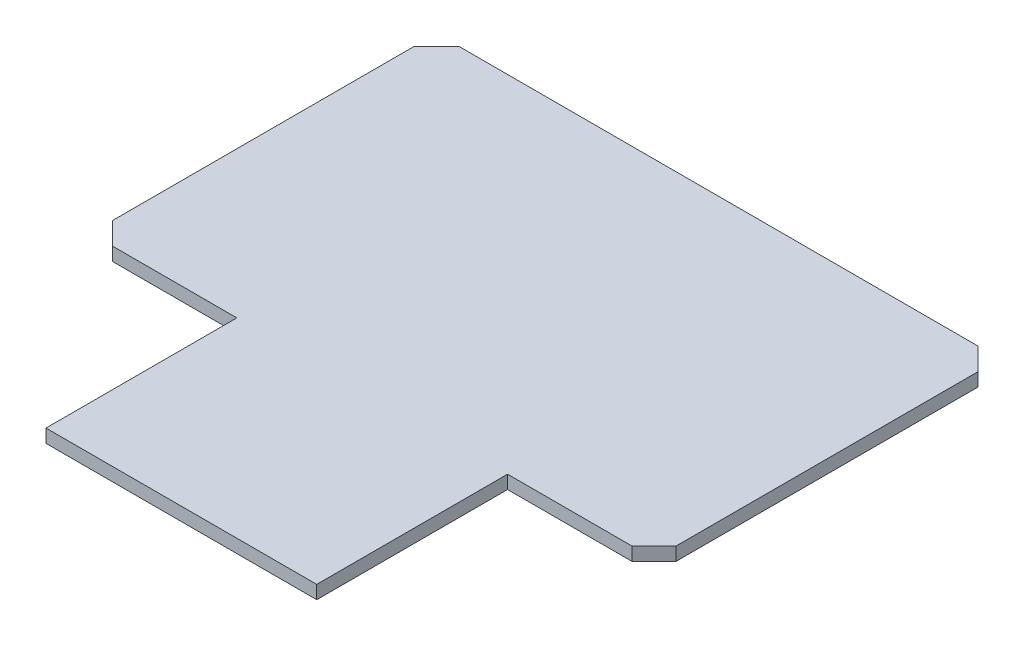
from build123d import *

# Parameters (mm, degrees)
BOSS_EXTRU_1_DEPTH = 3
CHANFREIN1_SIZE    = 5


with BuildPart() as part:
    # Esquisse1 → Boss.-Extru.1 (new body)
    with BuildSketch(Plane(origin=(0, 0, 0), x_dir=(1, 0, 0), z_dir=(0, 1, 0))):
        Polygon((0, 0), (-30.5, 0), (-30.5, 43), (-63.5, 43), (-63.5, 121), (63.5, 121), (63.5, 43), (30.5, 43), (30.5, 0), align=None)
    extrude(amount=BOSS_EXTRU_1_DEPTH)

    # Chanfrein1
    chanfrein1_edges = [part.edges().sort_by_distance(p)[0] for p in [
        (-63.5, 1.5, -43),
        (-63.5, 1.5, -121),
        (63.5, 1.5, -121),
        (63.5, 1.5, -43),
    ]]
    chamfer(chanfrein1_edges, length=CHANFREIN1_SIZE)


solid = part.part
